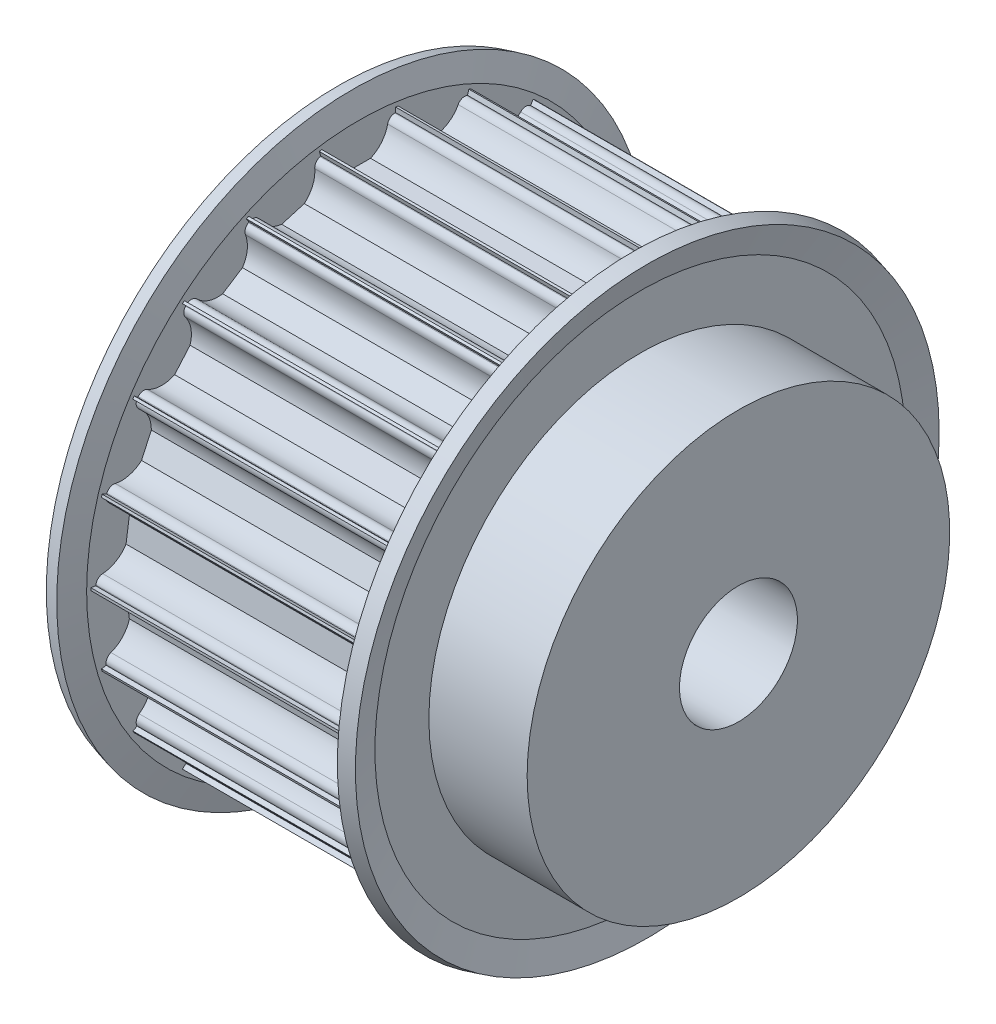
from build123d import *

# Parameters (mm, degrees)
CUT_EXTRUDE1_DEPTH = 56.543901555
CIRPATTERN1_COUNT  = 22


with BuildPart() as part:
    # Sketch2 → Revolve1 (revolve)
    with BuildSketch(Plane.XY, mode=Mode.PRIVATE) as revolve1_sk:
        Polygon((0, 6), (0, 27.25), (30, 27.25), (30, 21.5), (40, 21.5), (40, 6), align=None)
    revolve(revolve1_sk.sketch.rotate(Axis((0, 0, 0), (1, 0, 0)), 90), axis=Axis((0, 0, 0), (1, 0, 0)))

    # Sketch3 → Cut-Extrude1 (cut, through all)
    with BuildSketch(Plane.ZY):
        with BuildLine():
            Line((-3.674234614, 26.5), (-3.75, 26.5))
            Line((-3.75, 26.5), (-3.75, 28.5))
            Line((-3.75, 28.5), (3.75, 28.5))
            Line((3.75, 28.5), (3.75, 26.5))
            Line((3.75, 26.5), (3.674234614, 26.5))
            ThreePointArc((3.674234614, 26.5), (3.199892965, 26.330947502), (2.939387691, 25.9))
            ThreePointArc((2.939387691, 25.9), (2.331759211, 24.612435701), (1.198957881, 23.75))
            Line((1.198957881, 23.75), (-1.198957881, 23.75))
            ThreePointArc((-1.198957881, 23.75), (-2.331759211, 24.612435701), (-2.939387691, 25.9))
            ThreePointArc((-2.939387691, 25.9), (-3.199892965, 26.330947502), (-3.674234614, 26.5))
        make_face()
    cut_extrude1 = extrude(amount=-CUT_EXTRUDE1_DEPTH, mode=Mode.SUBTRACT)

    # CirPattern1: Cut-Extrude1 ×22 about axis
    cirpattern1_axis = Axis((0, 0, 0), (1, 0, 0))
    for i in range(1, CIRPATTERN1_COUNT):
        add(cut_extrude1.rotate(cirpattern1_axis, i * 360 / CIRPATTERN1_COUNT), mode=Mode.SUBTRACT)

    # Sketch4 → Revolve2 (revolve)
    with BuildSketch(Plane.XY, mode=Mode.PRIVATE) as revolve2_sk:
        Polygon((30, 21.5), (28.634691844, 21.5), (28.634691844, 27.69), (29.277769905, 30.09), (30.726658645, 29.701771432), (30, 26.98984445), align=None)
        Polygon((0, 21.5), (1.365308156, 21.5), (1.365308156, 27.69), (0.722230095, 30.09), (-0.726658645, 29.701771432), (0, 26.98984445), align=None)
    revolve(revolve2_sk.sketch.rotate(Axis((0, 0, 0), (-1, 0, 0)), 90), axis=Axis((0, 0, 0), (-1, 0, 0)))


solid = part.part
